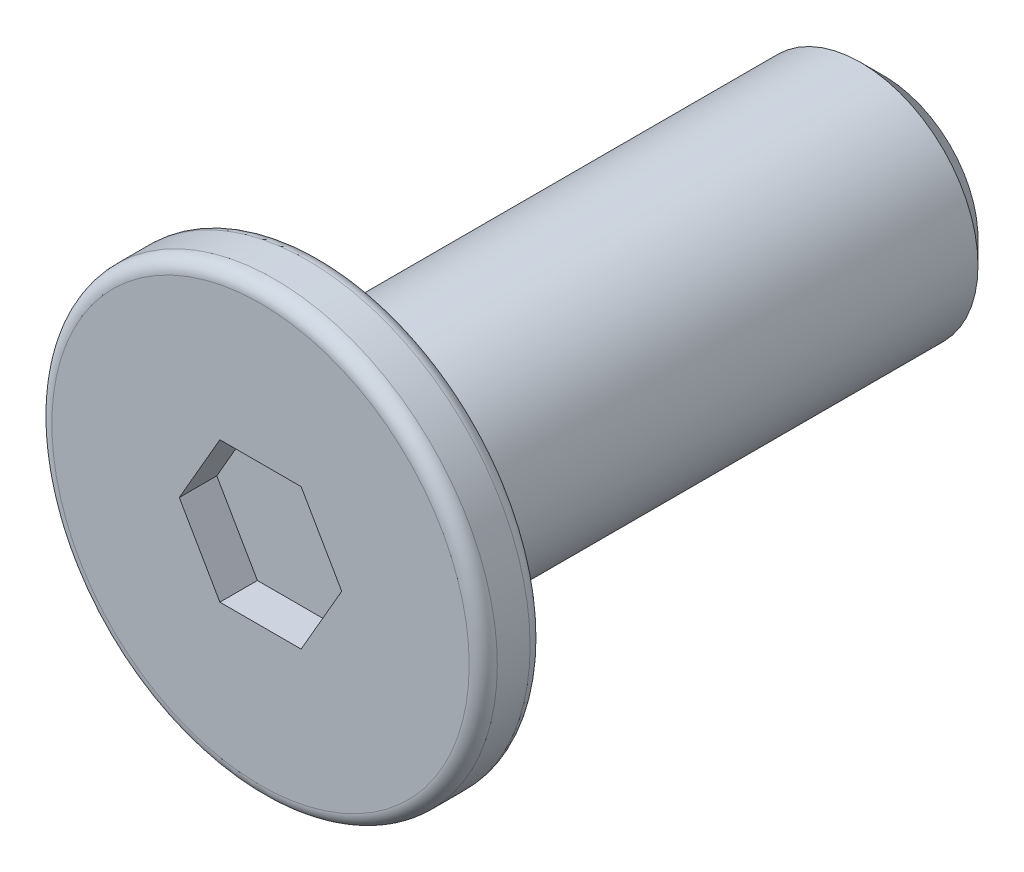
from build123d import *

# Parameters (mm, degrees)
SKETCH_1_R          = 4.75
EXTRUDE_1_DEPTH     = 0.65
SKETCH_2_R          = 2.5
EXTRUDE_2_DEPTH     = 12
CHAMFER_1_SIZE      = 0.5
CUT_EXTRUDE_1_DEPTH = 0.8
FILLET_2_R          = 0.3


with BuildPart() as part:
    # 草图1 → 凸台-拉伸1 (new, symmetric)
    with BuildSketch(Plane.XY):
        Circle(SKETCH_1_R)
    extrude(amount=EXTRUDE_1_DEPTH, both=True)

    # 草图2 → 凸台-拉伸2 (add)
    with BuildSketch(Plane(origin=(0, 0, -0.65), x_dir=(-1, 0, 0), z_dir=(0, 0, -1))):
        Circle(SKETCH_2_R)
    extrude(amount=EXTRUDE_2_DEPTH)

    # 倒角1
    chamfer_1_edges = [part.edges().sort_by_distance(p)[0] for p in [
        (2.5, 0, -12.65),
    ]]
    chamfer(chamfer_1_edges, length=CHAMFER_1_SIZE)

    # 草图3 → 切除-拉伸1 (cut)
    with BuildSketch(Plane.XY.offset(0.65)):
        Polygon((1.732050808, 0), (0.866025404, 1.5), (-0.866025404, 1.5), (-1.732050808, 0), (-0.866025404, -1.5), (0.866025404, -1.5), align=None)
    extrude(amount=-CUT_EXTRUDE_1_DEPTH, mode=Mode.SUBTRACT)

    # 圆角2
    fillet_2_edges = [part.edges().sort_by_distance(p)[0] for p in [
        (-4.75, 0, -0.65),
        (-4.75, 0, 0.65),
    ]]
    fillet(fillet_2_edges, radius=FILLET_2_R)


solid = part.part
